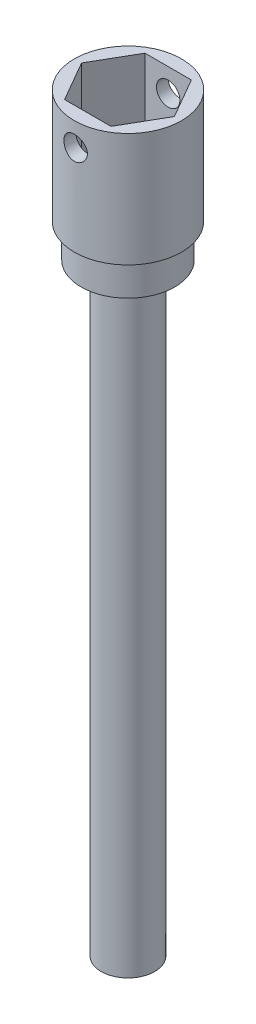
from build123d import *

# Parameters (mm, degrees)
SKETCH1_R               = 8
BOSS_EXTRUDE1_DEPTH     = 17
CUT_EXTRUDE2_DEPTH      = 24.430749028
CUT_EXTRUDE2_DEPTH_BACK = 24.430749028
SKETCH2_R               = 1.75
SKETCH3_R               = 4
BOSS_EXTRUDE2_DEPTH     = 95
SKETCH5_R               = 7
SKETCH5_R_2             = 4.005
BOSS_EXTRUDE8_DEPTH     = 5


with BuildPart() as part:
    # Sketch1 → Boss-Extrude1 (new body)
    with BuildSketch(Plane(origin=(0, 0, 0), x_dir=(-1, 0, 0), z_dir=(0, 1, 0))):
        Circle(SKETCH1_R)
        Polygon((6.92820323, 0), (3.464101615, 6), (-3.464101615, 6), (-6.92820323, 0), (-3.464101615, -6), (3.464101615, -6), align=None, mode=Mode.SUBTRACT)
    extrude(amount=BOSS_EXTRUDE1_DEPTH)

    # Sketch2 → Cut-Extrude2 (cut, two sides: drawn at the far end of the back side and taken through both)
    with BuildSketch(Plane.XY.offset(-6).offset(-CUT_EXTRUDE2_DEPTH_BACK)):
        with Locations((0, 13.5)):
            Circle(SKETCH2_R)
    extrude(amount=CUT_EXTRUDE2_DEPTH + CUT_EXTRUDE2_DEPTH_BACK, mode=Mode.SUBTRACT)


with BuildPart() as body_2:
    # Sketch3 → Boss-Extrude2 (new body)
    with BuildSketch(Plane.XZ):
        Circle(SKETCH3_R)
    extrude(amount=BOSS_EXTRUDE2_DEPTH)


with BuildPart() as body_3:
    # Sketch5 → Boss-Extrude8 (new body)
    with BuildSketch(Plane.XZ):
        Circle(SKETCH5_R)
        Circle(SKETCH5_R_2, mode=Mode.SUBTRACT)
    extrude(amount=BOSS_EXTRUDE8_DEPTH)


solid = Compound([part.part, body_2.part, body_3.part])
